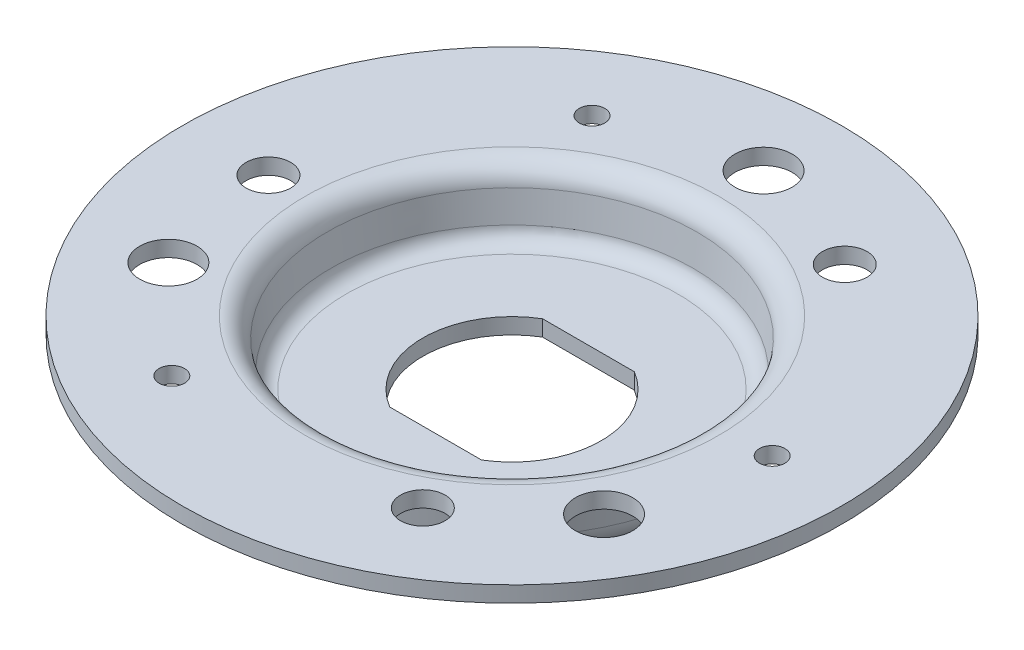
from build123d import *

# Parameters (mm, degrees)
CORTE_EXTRUS_O1_DEPTH      = 74.865587387
CORTE_EXTRUS_O1_DEPTH_BACK = 74.865587387
ESBO_O2_R                  = 4.5
ESBO_O2_R_2                = 2
ESBO_O2_R_3                = 3.5


with BuildPart() as part:
    # Esboço1 → Revolução1 (revolve)
    with BuildSketch(Plane(origin=(0, 0, 0), x_dir=(0, 0, -1), z_dir=(1, 0, 0))):
        with BuildLine():
            Line((-12, 0), (-26, 0))
            ThreePointArc((-26, 0), (-29.327269348, 1.267805111), (-30.967207061, 4.428288525))
            Line((-30.967207061, 4.428288525), (-31.506558588, 9.114342295))
            ThreePointArc((-31.506558588, 9.114342295), (-31.83454613, 9.746438978), (-32.5, 10))
            Line((-32.5, 10), (-51.75, 10))
            Line((-51.75, 10), (-51.75, 12.5))
            Line((-51.75, 12.5), (-32.5, 12.5))
            ThreePointArc((-32.5, 12.5), (-30.170911456, 11.612536422), (-29.022955057, 9.400198032))
            Line((-29.022955057, 9.400198032), (-28.483603531, 4.714144263))
            ThreePointArc((-28.483603531, 4.714144263), (-27.663634674, 3.133902556), (-26, 2.5))
            Line((-26, 2.5), (-12, 2.5))
            Line((-12, 2.5), (-12, 0))
        make_face()
    revolve(axis=Axis((0, 0, 0), (0, -1, 0)))

    # Esboço2 → Corte-extrusão1 (cut, two sides: drawn at the far end of the back side and taken through both)
    with BuildSketch(Plane(origin=(0, 2.5, 0), x_dir=(1, 0, 0), z_dir=(0, 1, 0)).offset(-CORTE_EXTRUS_O1_DEPTH_BACK)):
        with Locations(Location((0, 39.5, 0), (0, 0, 270))):
            Circle(ESBO_O2_R)
        with Locations(Location((-20.931810937, 33.497899798, 0), (0, 0, 270))):
            Circle(ESBO_O2_R_2)
        with Locations(Location((19.125, 33.125471695, 0), (0, 0, 270))):
            Circle(ESBO_O2_R_3)
        with Locations(Location((19.125, -33.125471695, 0), (0, 0, 270))):
            Circle(ESBO_O2_R_3)
        with Locations(Location((34.208003449, -19.75, 0), (0, 0, 270))):
            Circle(ESBO_O2_R)
        with Locations(Location((39.475937667, 1.37853012, 0), (0, 0, 270))):
            Circle(ESBO_O2_R_2)
        with Locations(Location((-38.25, 0, 0), (0, 0, 270))):
            Circle(ESBO_O2_R_3)
        with Locations(Location((-34.208003449, -19.75, 0), (0, 0, 270))):
            Circle(ESBO_O2_R)
        with Locations(Location((-18.54412673, -34.876429918, 0), (0, 0, 270))):
            Circle(ESBO_O2_R_2)
        with BuildLine():
            Line((-7.211102551, 12), (7.211102551, 12))
            ThreePointArc((7.211102551, 12), (14, 0), (7.211102551, -12))
            Line((7.211102551, -12), (-7.211102551, -12))
            ThreePointArc((-7.211102551, -12), (-14, 0), (-7.211102551, 12))
        make_face()
    extrude(amount=CORTE_EXTRUS_O1_DEPTH + CORTE_EXTRUS_O1_DEPTH_BACK, mode=Mode.SUBTRACT)


solid = part.part
